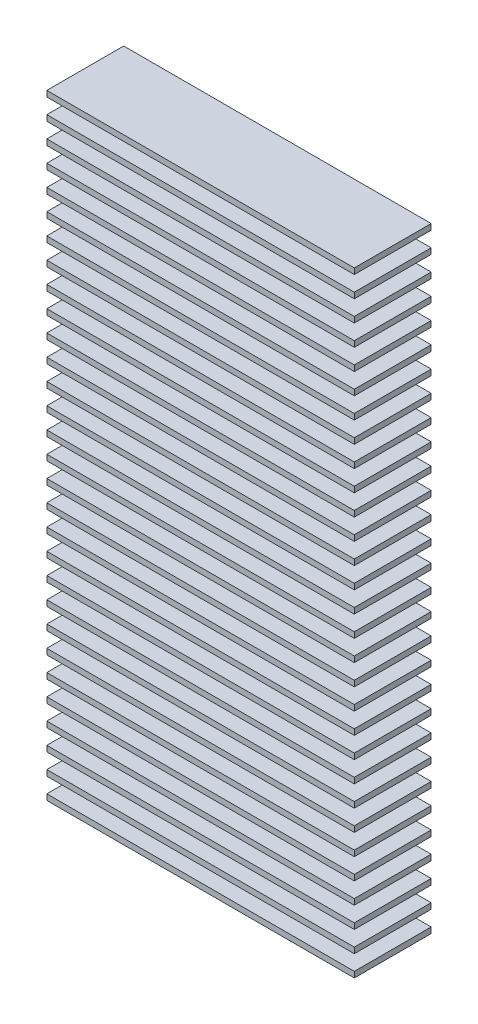
from build123d import *

# Parameters (mm, degrees)
SKETCH14_R            = 5
BOSS_EXTRUDE1_DEPTH   = 160
BOSS_EXTRUDE1_2_DEPTH = 160
SKETCH15_W            = 160
SKETCH15_H            = 40
BOSS_EXTRUDE2_DEPTH   = 3
LPATTERN1_COUNT       = 30
LPATTERN1_PITCH       = 10.931034483


with BuildPart() as part:
    # Sketch14 → Boss-Extrude1 (new, symmetric)
    with BuildSketch(Plane(origin=(0, 0, 0), x_dir=(1, 0, 0), z_dir=(0, 1, 0))):
        with Locations(Location((-40, 0, 0), (0, 0, 270))):
            Circle(SKETCH14_R)
    extrude(amount=BOSS_EXTRUDE1_DEPTH, both=True)



with BuildPart() as body_2:
    # Sketch14 → Boss-Extrude1 2 (new, symmetric)
    with BuildSketch(Plane(origin=(0, 0, 0), x_dir=(1, 0, 0), z_dir=(0, 1, 0))):
        with Locations(Location((40, 0, 0), (0, 0, 270))):
            Circle(SKETCH14_R)
    extrude(amount=BOSS_EXTRUDE1_2_DEPTH, both=True)


with BuildPart() as part_1:
    add(part.part)

    add(body_2.part)  # Boss-Extrude2 merges body 2
    # Sketch15 → Boss-Extrude2 (add)
    with BuildSketch(Plane(origin=(0, 160, 0), x_dir=(1, 0, 0), z_dir=(0, 1, 0))):
        Rectangle(SKETCH15_W, SKETCH15_H)
    boss_extrude2 = extrude(amount=-BOSS_EXTRUDE2_DEPTH)

    # LPattern1: Boss-Extrude2 ×30
    with Locations(*[(0, -i * LPATTERN1_PITCH, 0) for i in range(1, LPATTERN1_COUNT)]):
        add(boss_extrude2)


solid = part_1.part
